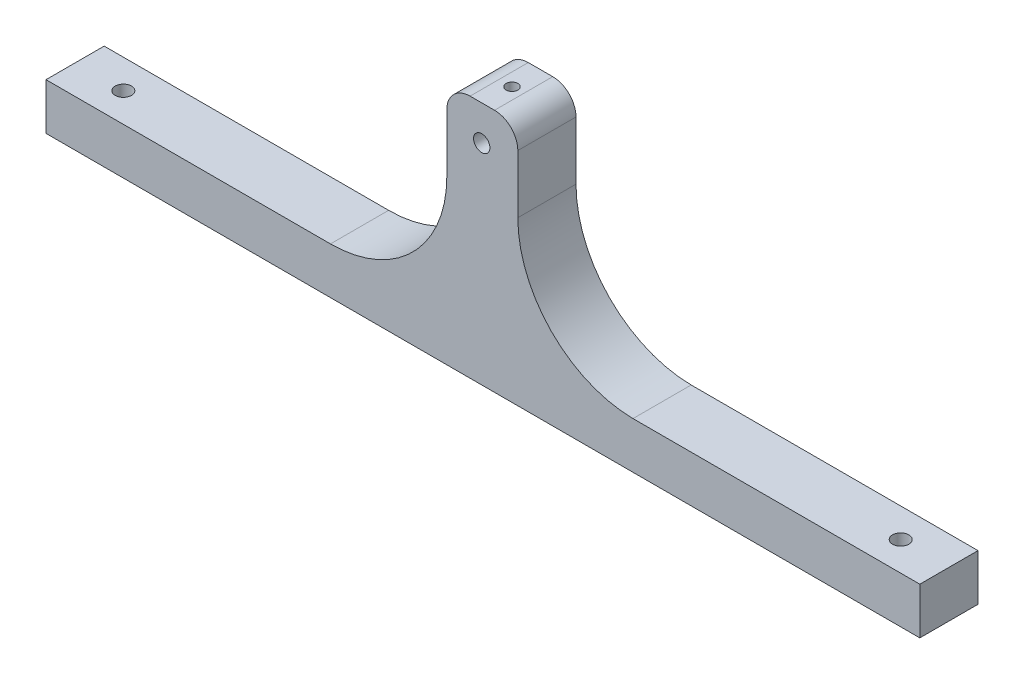
from build123d import *

# Parameters (mm, degrees)
SKETCH1_W           = 75.1
SKETCH1_H           = 5
SKETCH1_R           = 0.7
SKETCH1_R_2         = 0.5
BOSS_EXTRUDE1_DEPTH = 4
BOSS_EXTRUDE2_DEPTH = 5
SKETCH4_R           = 0.5
CUT_EXTRUDE1_DEPTH  = 33
SKETCH5_R           = 0.702970984
CUT_EXTRUDE2_DEPTH  = 10


with BuildPart() as part:
    # Sketch1 → Boss-Extrude1 (new body)
    with BuildSketch(Plane(origin=(0, 0, 0), x_dir=(1, 0, 0), z_dir=(0, 1, 0))):
        Rectangle(SKETCH1_W, SKETCH1_H)
        with Locations(Location((-33.405, 0, 0), (0, 0, 270))):
            Circle(SKETCH1_R, mode=Mode.SUBTRACT)
        with Locations(Location((33.405, 0, 0), (0, 0, 270))):
            Circle(SKETCH1_R, mode=Mode.SUBTRACT)
        with Locations(Location((0, 0, 0), (0, 0, 270))):
            Circle(SKETCH1_R_2, mode=Mode.SUBTRACT)
    extrude(amount=BOSS_EXTRUDE1_DEPTH)

    # Sketch3 → Boss-Extrude2 (add)
    with BuildSketch(Plane.XY.offset(2.5)):
        with BuildLine():
            Line((-13.101977393, 4), (12.898022607, 4))
            ThreePointArc((12.898022607, 4), (5.892969188, 6.964559048), (3, 13.999480017))
            Line((3, 13.999480017), (3, 19))
            ThreePointArc((3, 19), (2.414213562, 20.414213562), (1, 21))
            Line((1, 21), (-1.101977393, 21))
            ThreePointArc((-1.101977393, 21), (-2.516190955, 20.414213562), (-3.101977393, 19))
            Line((-3.101977393, 19), (-3.101977393, 14))
            ThreePointArc((-3.101977393, 14), (-6.030909581, 6.928932188), (-13.101977393, 4))
        make_face()
    extrude(amount=-BOSS_EXTRUDE2_DEPTH)

    # Sketch4 → Cut-Extrude1 (cut)
    with BuildSketch(Plane.XZ):
        with Locations(Location((0, 0, 0), (0, 0, 90))):
            Circle(SKETCH4_R)
    extrude(amount=-CUT_EXTRUDE1_DEPTH, mode=Mode.SUBTRACT)

    # Sketch5 → Cut-Extrude2 (cut)
    with BuildSketch(Plane.XY.offset(2.5)):
        with Locations((-0.101977393, 18)):
            Circle(SKETCH5_R)
    extrude(amount=-CUT_EXTRUDE2_DEPTH, mode=Mode.SUBTRACT)


solid = part.part
